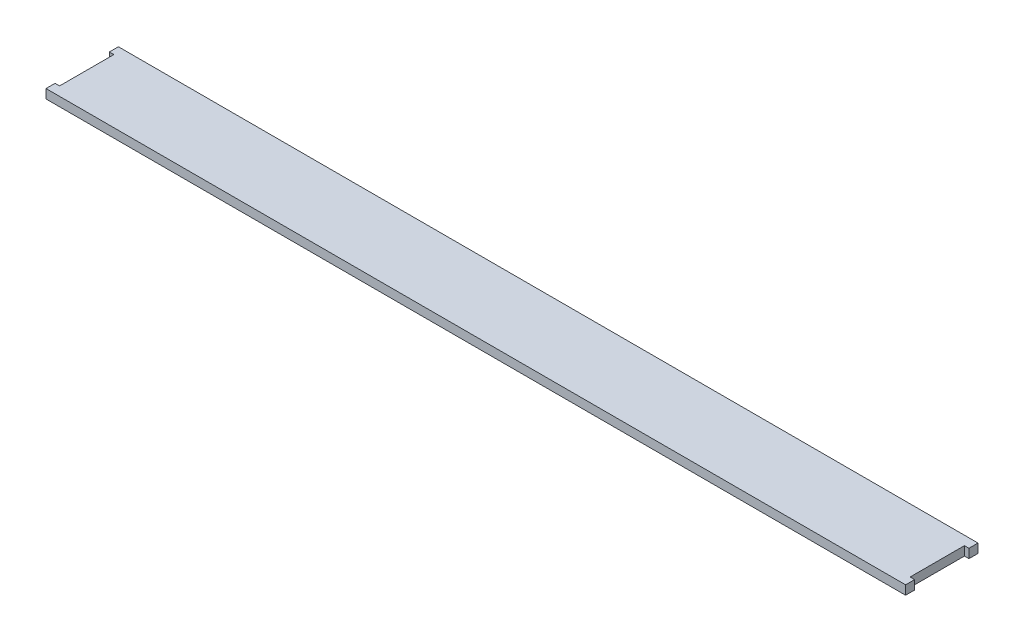
from build123d import *

# Parameters (mm, degrees)
BOSS_EXTRUDE1_DEPTH = 6.35


with BuildPart() as part:
    # Sketch1 → Boss-Extrude1 (new body)
    with BuildSketch(Plane(origin=(0, 0, 0), x_dir=(1, 0, 0), z_dir=(0, 1, 0))):
        Polygon((-298.45, 21.811459272), (-298.45, -16.288540728), (-301.625, -16.288540728), (-301.625, -22.638540728), (301.625, -22.638540728), (301.625, -16.288540728), (298.45, -16.288540728), (298.45, 21.811459272), (301.625, 21.811459272), (301.625, 28.161459272), (-301.625, 28.161459272), (-301.625, 21.811459272), align=None)
    extrude(amount=BOSS_EXTRUDE1_DEPTH)


solid = part.part
